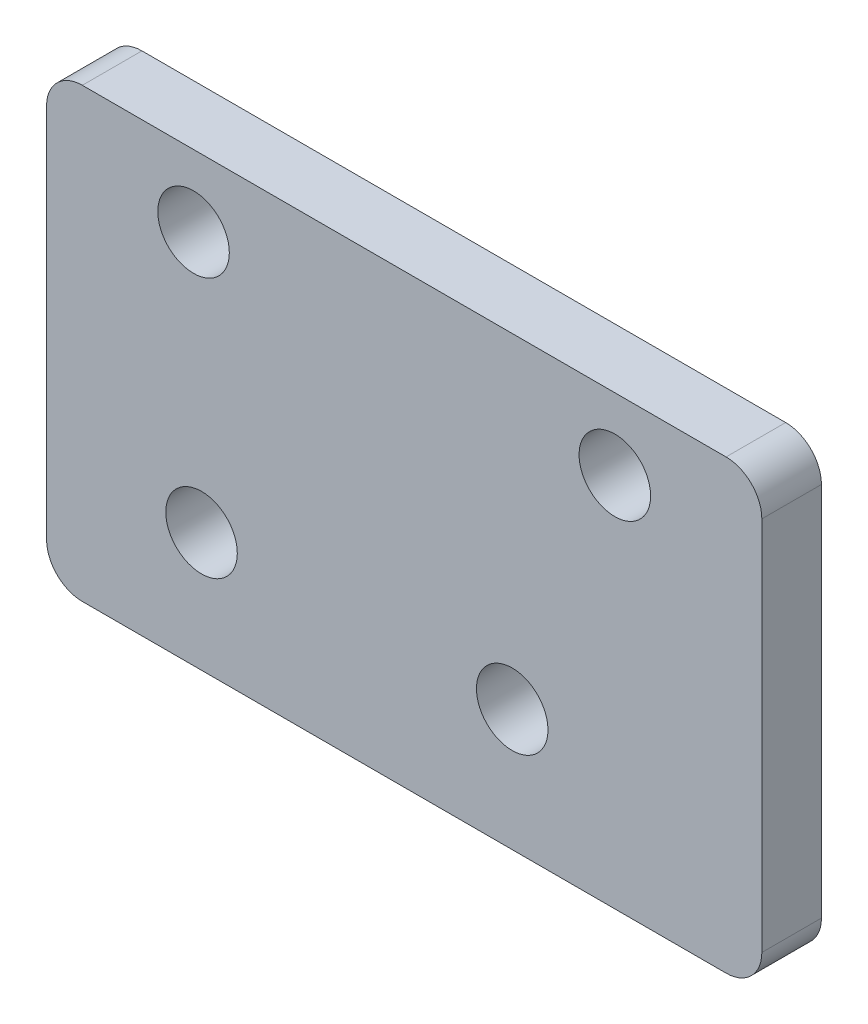
from build123d import *

# Parameters (mm, degrees)
EXTRUDE_1_DEPTH     = 5
SKETCH_2_R          = 3
CUT_EXTRUDE_1_DEPTH = 10
SKETCH_4_R          = 3
CUT_EXTRUDE_2_DEPTH = 10
SKETCH_9_R          = 3
CUT_EXTRUDE_3_DEPTH = 10


with BuildPart() as part:
    # 草图1 → 凸台-拉伸1 (new body)
    with BuildSketch(Plane.XY):
        with BuildLine():
            Line((-15.5, 27.5), (38.5, 27.5))
            ThreePointArc((38.5, 27.5), (40.621320344, 26.621320344), (41.5, 24.5))
            Line((41.5, 24.5), (41.5, -7))
            ThreePointArc((41.5, -7), (40.621320344, -9.121320344), (38.5, -10))
            Line((38.5, -10), (33.3, -10))
            Line((33.3, -10), (31.175, -10))
            Line((31.175, -10), (-8.825, -10))
            Line((-8.825, -10), (-15.5, -10))
            ThreePointArc((-15.5, -10), (-17.621320344, -9.121320344), (-18.5, -7))
            Line((-18.5, -7), (-18.5, 24.5))
            ThreePointArc((-18.5, 24.5), (-17.621320344, 26.621320344), (-15.5, 27.5))
        make_face()
    extrude(amount=EXTRUDE_1_DEPTH)

    # 草图2 → 切除-拉伸1 (cut)
    with BuildSketch(Plane.XY.offset(5)):
        with Locations((-6.17, 21.5)):
            Circle(SKETCH_2_R)
        with Locations((29.17, 21.5)):
            Circle(SKETCH_2_R)
    extrude(amount=-CUT_EXTRUDE_1_DEPTH, mode=Mode.SUBTRACT)

    # 草图4 → 切除-拉伸2 (cut)
    with BuildSketch(Plane.XY.offset(5)):
        with Locations((-5.5, 0)):
            Circle(SKETCH_4_R)
    extrude(amount=-CUT_EXTRUDE_2_DEPTH, mode=Mode.SUBTRACT)

    # 草图9 → 切除-拉伸3 (cut)
    with BuildSketch(Plane.XY.offset(5)):
        with Locations((20.56, 0.2)):
            Circle(SKETCH_9_R)
    extrude(amount=-CUT_EXTRUDE_3_DEPTH, mode=Mode.SUBTRACT)


solid = part.part
